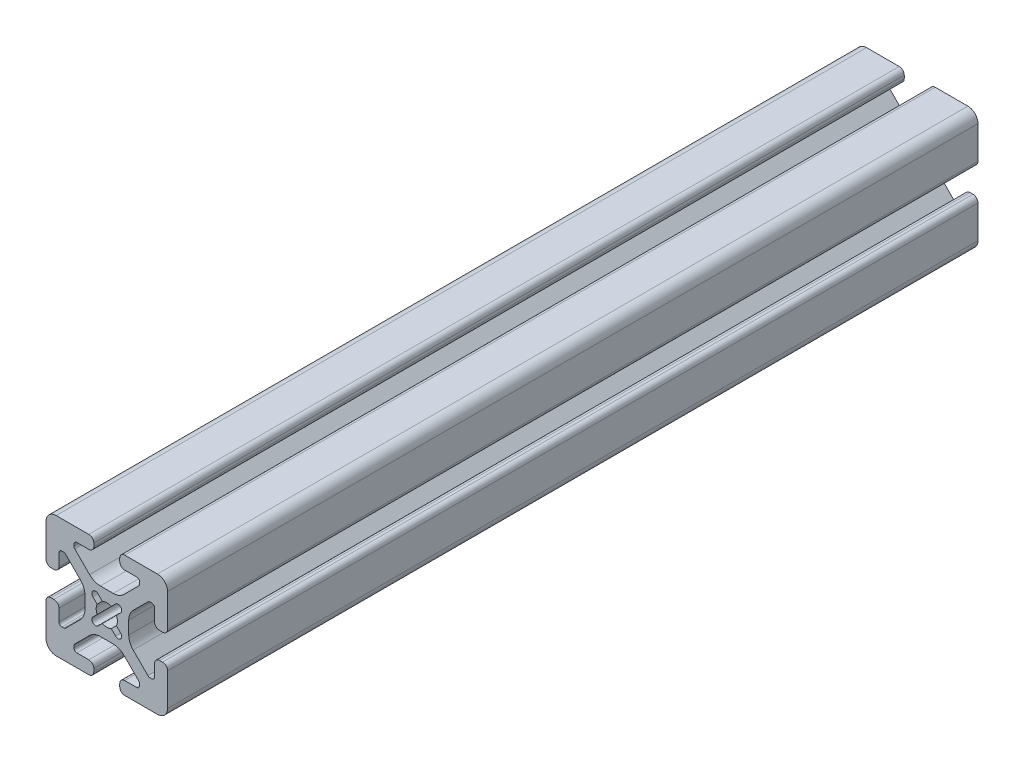
from build123d import *

# Parameters (mm, degrees)
EXTRUDE1_DEPTH = 254


with BuildPart() as part:
    # Sketch1 → Extrude1 (new body)
    with BuildSketch(Plane.XY):
        with BuildLine():
            Line((14.986, -5.6388), (14.986, -9.398))
            ThreePointArc((14.986, -9.398), (14.725617928, -10.026617928), (14.097, -10.287))
            Line((14.097, -10.287), (13.528917816, -10.287))
            ThreePointArc((13.528917816, -10.287), (13.188712244, -10.219328904), (12.900299887, -10.026617928))
            Line((12.900299887, -10.026617928), (8.260840349, -5.38715839))
            ThreePointArc((8.260840349, -5.38715839), (7.231213135, -3.846212368), (6.869656138, -2.028542601))
            Line((6.869656138, -2.028542601), (6.869656138, 2.028542601))
            ThreePointArc((6.869656138, 2.028542601), (7.231213135, 3.846212368), (8.260840349, 5.38715839))
            Line((8.260840349, 5.38715839), (12.900299887, 10.026617929))
            ThreePointArc((12.900299887, 10.026617929), (13.188712244, 10.219328904), (13.528917816, 10.287))
            Line((13.528917816, 10.287), (14.097, 10.287))
            ThreePointArc((14.097, 10.287), (14.725617928, 10.026617929), (14.986, 9.398))
            Line((14.986, 9.398), (14.986, 5.6388))
            ThreePointArc((14.986, 5.6388), (15.447248241, 4.525248241), (16.5608, 4.064))
            Line((16.5608, 4.064), (17.4752, 4.064))
            ThreePointArc((17.4752, 4.064), (18.588751759, 4.525248241), (19.05, 5.6388))
            Line((19.05, 5.6388), (19.05, 15.875))
            ThreePointArc((19.05, 15.875), (18.12006403, 18.12006403), (15.875, 19.05))
            Line((15.875, 19.05), (5.6388, 19.05))
            ThreePointArc((5.6388, 19.05), (4.525248241, 18.588751759), (4.064, 17.4752))
            Line((4.064, 17.4752), (4.064, 16.5608))
            ThreePointArc((4.064, 16.5608), (4.525248241, 15.447248241), (5.6388, 14.986))
            Line((5.6388, 14.986), (9.398, 14.986))
            ThreePointArc((9.398, 14.986), (10.026617928, 14.725617928), (10.287, 14.097))
            Line((10.287, 14.097), (10.287, 13.528917816))
            ThreePointArc((10.287, 13.528917816), (10.219328904, 13.188712244), (10.026617928, 12.900299887))
            Line((10.026617928, 12.900299887), (5.38715839, 8.260840349))
            ThreePointArc((5.38715839, 8.260840349), (3.846212368, 7.231213135), (2.028542601, 6.869656138))
            Line((2.028542601, 6.869656138), (-2.028542601, 6.869656138))
            ThreePointArc((-2.028542601, 6.869656138), (-3.846212368, 7.231213135), (-5.38715839, 8.260840349))
            Line((-5.38715839, 8.260840349), (-10.026617929, 12.900299887))
            ThreePointArc((-10.026617929, 12.900299887), (-10.219328904, 13.188712244), (-10.287, 13.528917816))
            Line((-10.287, 13.528917816), (-10.287, 14.097))
            ThreePointArc((-10.287, 14.097), (-10.026617929, 14.725617928), (-9.398, 14.986))
            Line((-9.398, 14.986), (-5.6388, 14.986))
            ThreePointArc((-5.6388, 14.986), (-4.525248241, 15.447248241), (-4.064, 16.5608))
            Line((-4.064, 16.5608), (-4.064, 17.4752))
            ThreePointArc((-4.064, 17.4752), (-4.525248241, 18.588751759), (-5.6388, 19.05))
            Line((-5.6388, 19.05), (-15.875, 19.05))
            ThreePointArc((-15.875, 19.05), (-18.12006403, 18.12006403), (-19.05, 15.875))
            Line((-19.05, 15.875), (-19.05, 5.6388))
            ThreePointArc((-19.05, 5.6388), (-18.588751759, 4.525248241), (-17.4752, 4.064))
            Line((-17.4752, 4.064), (-16.5608, 4.064))
            ThreePointArc((-16.5608, 4.064), (-15.447248241, 4.525248241), (-14.986, 5.6388))
            Line((-14.986, 5.6388), (-14.986, 9.398))
            ThreePointArc((-14.986, 9.398), (-14.725617929, 10.026617928), (-14.097, 10.287))
            Line((-14.097, 10.287), (-13.528917816, 10.287))
            ThreePointArc((-13.528917816, 10.287), (-13.188712244, 10.219328904), (-12.900299887, 10.026617928))
            Line((-12.900299887, 10.026617928), (-8.260840349, 5.38715839))
            ThreePointArc((-8.260840349, 5.38715839), (-7.231213135, 3.846212368), (-6.869656138, 2.028542601))
            Line((-6.869656138, 2.028542601), (-6.869656138, -2.028542601))
            ThreePointArc((-6.869656138, -2.028542601), (-7.231213135, -3.846212368), (-8.260840349, -5.38715839))
            Line((-8.260840349, -5.38715839), (-12.900299887, -10.026617928))
            ThreePointArc((-12.900299887, -10.026617928), (-13.188712244, -10.219328904), (-13.528917816, -10.287))
            Line((-13.528917816, -10.287), (-14.097, -10.287))
            ThreePointArc((-14.097, -10.287), (-14.725617928, -10.026617928), (-14.986, -9.398))
            Line((-14.986, -9.398), (-14.986, -5.6388))
            ThreePointArc((-14.986, -5.6388), (-15.447248241, -4.525248241), (-16.5608, -4.064))
            Line((-16.5608, -4.064), (-17.4752, -4.064))
            ThreePointArc((-17.4752, -4.064), (-18.588751759, -4.525248241), (-19.05, -5.6388))
            Line((-19.05, -5.6388), (-19.05, -15.875))
            ThreePointArc((-19.05, -15.875), (-18.12006403, -18.12006403), (-15.875, -19.05))
            Line((-15.875, -19.05), (-5.6388, -19.05))
            ThreePointArc((-5.6388, -19.05), (-4.525248241, -18.588751759), (-4.064, -17.4752))
            Line((-4.064, -17.4752), (-4.064, -16.5608))
            ThreePointArc((-4.064, -16.5608), (-4.525248241, -15.447248241), (-5.6388, -14.986))
            Line((-5.6388, -14.986), (-9.398, -14.986))
            ThreePointArc((-9.398, -14.986), (-10.026617928, -14.725617928), (-10.287, -14.097))
            Line((-10.287, -14.097), (-10.287, -13.528917816))
            ThreePointArc((-10.287, -13.528917816), (-10.219328904, -13.188712244), (-10.026617928, -12.900299887))
            Line((-10.026617928, -12.900299887), (-5.38715839, -8.260840349))
            ThreePointArc((-5.38715839, -8.260840349), (-3.846212368, -7.231213135), (-2.028542601, -6.869656138))
            Line((-2.028542601, -6.869656138), (2.028542601, -6.869656138))
            ThreePointArc((2.028542601, -6.869656138), (3.846212368, -7.231213135), (5.38715839, -8.260840349))
            Line((5.38715839, -8.260840349), (10.026617928, -12.900299887))
            ThreePointArc((10.026617928, -12.900299887), (10.219328904, -13.188712244), (10.287, -13.528917816))
            Line((10.287, -13.528917816), (10.287, -14.097))
            ThreePointArc((10.287, -14.097), (10.026617928, -14.725617928), (9.398, -14.986))
            Line((9.398, -14.986), (5.6388, -14.986))
            ThreePointArc((5.6388, -14.986), (4.525248241, -15.447248241), (4.064, -16.5608))
            Line((4.064, -16.5608), (4.064, -17.4752))
            ThreePointArc((4.064, -17.4752), (4.525248241, -18.588751759), (5.6388, -19.05))
            Line((5.6388, -19.05), (15.875, -19.05))
            ThreePointArc((15.875, -19.05), (18.12006403, -18.12006403), (19.05, -15.875))
            Line((19.05, -15.875), (19.05, -5.6388))
            ThreePointArc((19.05, -5.6388), (18.588751759, -4.525248241), (17.4752, -4.064))
            Line((17.4752, -4.064), (16.5608, -4.064))
            ThreePointArc((16.5608, -4.064), (15.447248241, -4.525248241), (14.986, -5.6388))
        make_face()
        with BuildLine():
            Line((4.24561082, 2.639761197), (3.01775857, 1.401686117))
            ThreePointArc((3.01775857, 1.401686117), (3.327399997, 0.000140662), (3.017877069, -1.401430967))
            Line((3.017877069, -1.401430967), (4.343300873, -2.726854771))
            ThreePointArc((4.343300873, -2.726854771), (4.343300873, -4.343300873), (2.726854771, -4.343300873))
            Line((2.726854771, -4.343300873), (1.401430967, -3.017877069))
            ThreePointArc((1.401430967, -3.017877069), (0, -3.3274), (-1.401430967, -3.017877069))
            Line((-1.401430967, -3.017877069), (-2.726854771, -4.343300873))
            ThreePointArc((-2.726854771, -4.343300873), (-4.343300873, -4.343300873), (-4.343300873, -2.726854771))
            Line((-4.343300873, -2.726854771), (-3.017877069, -1.401430967))
            ThreePointArc((-3.017877069, -1.401430967), (-3.3274, 0), (-3.017877069, 1.401430967))
            Line((-3.017877069, 1.401430967), (-4.343300873, 2.726854771))
            ThreePointArc((-4.343300873, 2.726854771), (-4.343300873, 4.343300873), (-2.726854771, 4.343300873))
            Line((-2.726854771, 4.343300873), (-1.401430967, 3.017877069))
            ThreePointArc((-1.401430967, 3.017877069), (0.000140662, 3.327399997), (1.401686117, 3.01775857))
            Line((1.401686117, 3.01775857), (2.639761197, 4.24561082))
            ThreePointArc((2.639761197, 4.24561082), (4.343300873, 4.343300873), (4.24561082, 2.639761197))
        make_face(mode=Mode.SUBTRACT)
    extrude(amount=-EXTRUDE1_DEPTH)


solid = part.part
